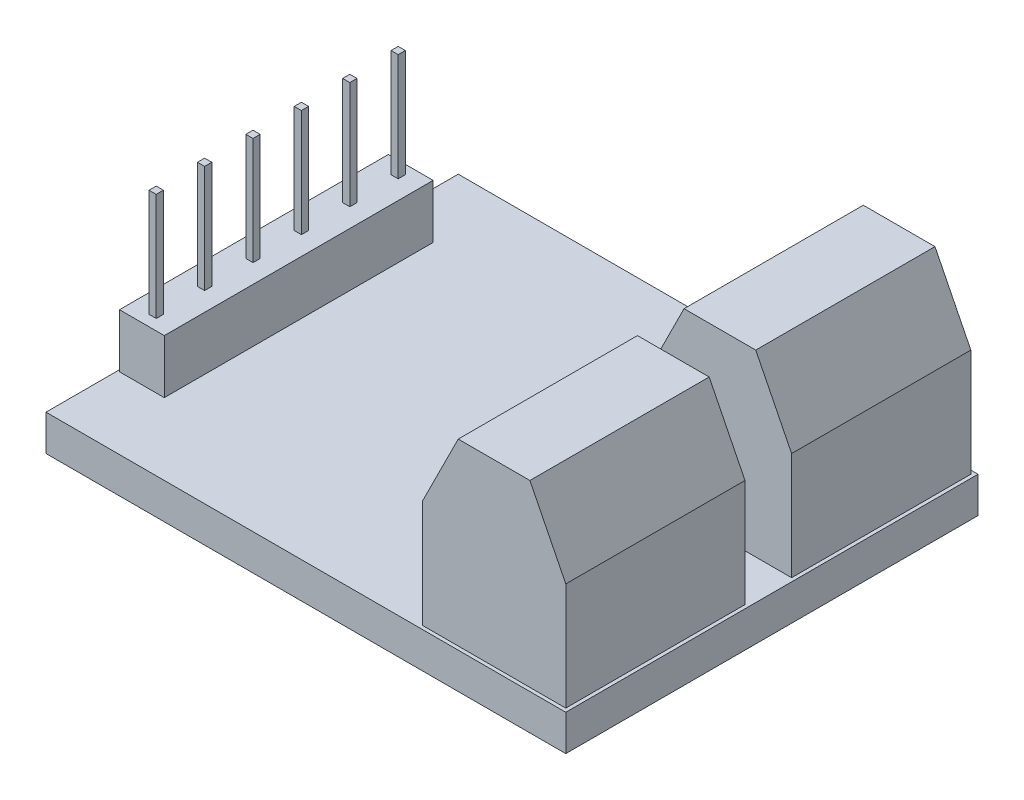
from build123d import *

# Parameters (mm, degrees)
SKETCH1_W           = 29
SKETCH1_H           = 23
BOSS_EXTRUDE1_DEPTH = 2
SKETCH2_W           = 8
SKETCH2_H           = 10
BOSS_EXTRUDE2_DEPTH = 10
CUT_EXTRUDE1_DEPTH  = 30.565013107
SKETCH5_W           = 2.5
SKETCH5_H           = 15
BOSS_EXTRUDE3_DEPTH = 3
SKETCH6_W           = 0.4
SKETCH6_H           = 0.4
BOSS_EXTRUDE4_DEPTH = 6


with BuildPart() as part:
    # Sketch1 → Boss-Extrude1 (new body)
    with BuildSketch(Plane(origin=(0, 0, 0), x_dir=(1, 0, 0), z_dir=(0, 1, 0))):
        Rectangle(SKETCH1_W, SKETCH1_H)
    extrude(amount=BOSS_EXTRUDE1_DEPTH)

    # Sketch2 → Boss-Extrude2 (add)
    with BuildSketch(Plane(origin=(0, 2, 0), x_dir=(1, 0, 0), z_dir=(0, 1, 0))):
        with Locations((10.3, -6.3)):
            Rectangle(SKETCH2_W, SKETCH2_H)
        with Locations((10.3, 6.3)):
            Rectangle(SKETCH2_W, SKETCH2_H)
    extrude(amount=BOSS_EXTRUDE2_DEPTH)

    # Sketch3 → Cut-Extrude1 (cut, through all)
    with BuildSketch(Plane.XY.offset(11.3)):
        Polygon((12.3, 12), (14.3, 12), (14.3, 8), align=None)
        Polygon((6.3, 12), (6.3, 8), (8.3, 12), align=None)
    extrude(amount=-CUT_EXTRUDE1_DEPTH, mode=Mode.SUBTRACT)

    # Sketch5 → Boss-Extrude3 (add)
    with BuildSketch(Plane(origin=(0, 2, 0), x_dir=(1, 0, 0), z_dir=(0, 1, 0))):
        with Locations((-13.15, 0)):
            Rectangle(SKETCH5_W, SKETCH5_H)
    extrude(amount=BOSS_EXTRUDE3_DEPTH)

    # Sketch6 → Boss-Extrude4 (add)
    with BuildSketch(Plane(origin=(0, 5, 0), x_dir=(1, 0, 0), z_dir=(0, 1, 0))):
        with Locations((-13.15, 6.8)):
            Rectangle(SKETCH6_W, SKETCH6_H)
        with Locations((-13.15, 4.1)):
            Rectangle(SKETCH6_W, SKETCH6_H)
        with Locations((-13.15, 1.4)):
            Rectangle(SKETCH6_W, SKETCH6_H)
        with Locations((-13.15, -1.3)):
            Rectangle(SKETCH6_W, SKETCH6_H)
        with Locations((-13.15, -4)):
            Rectangle(SKETCH6_W, SKETCH6_H)
        with Locations((-13.15, -6.7)):
            Rectangle(SKETCH6_W, SKETCH6_H)
    extrude(amount=BOSS_EXTRUDE4_DEPTH)


solid = part.part
